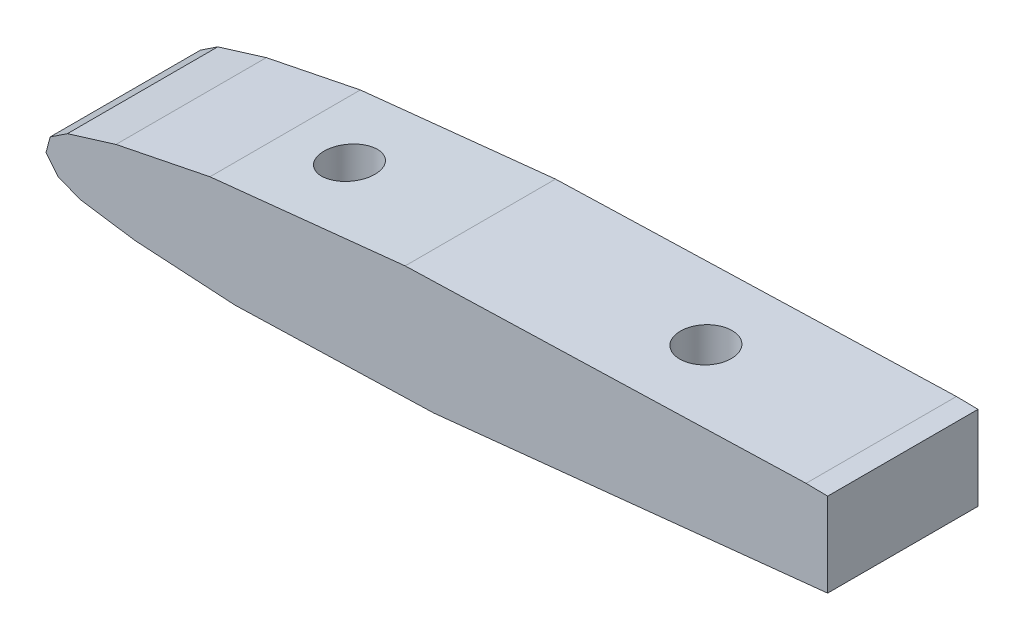
from build123d import *

# Parameters (mm, degrees)
BOSS_EXTRUDE1_DEPTH = 15
SKETCH4_R           = 2.54
CUT_EXTRUDE1_DEPTH  = 12.7
SKETCH5_R           = 2.54
CUT_EXTRUDE2_DEPTH  = 15.24
SKETCH6_W           = 50.620820664
SKETCH6_H           = 16.798394225
CUT_EXTRUDE3_DEPTH  = 15.24


with BuildPart() as part:
    # Sketch1 → Boss-Extrude1 (new body)
    with BuildSketch(Plane.XY):
        Polygon((-45.368681743, 5.31474447), (-45.781639963, 3.744360676), (-44.597190062, 2.280798517), (-42.364651707, 1.40510115), (-36.927606101, 0.59697268), (-26.918722281, 0), (-7.083221645, 0.593485987), (32.186093563, 4.677985502), (81.310277275, 12.243232279), (30.045684711, 13.095295678), (-9.952974473, 11.878999191), (-29.421950259, 9.844122216), (-38.797603286, 7.950869725), (-43.648710425, 6.454753464), align=None)
    extrude(amount=BOSS_EXTRUDE1_DEPTH)

    # Sketch4 → Cut-Extrude1 (cut)
    with BuildSketch(Plane(origin=(0, 0, 0), x_dir=(1, 0, 0), z_dir=(0, 1, 0))):
        with Locations(Location((-23.007190062, -7.5, 0), (0, 0, 180))):
            Circle(SKETCH4_R)
    extrude(amount=CUT_EXTRUDE1_DEPTH, mode=Mode.SUBTRACT)

    # Sketch5 → Cut-Extrude2 (cut)
    with BuildSketch(Plane(origin=(0, 0, 0), x_dir=(1, 0, 0), z_dir=(0, 1, 0))):
        with Locations(Location((12.552809938, -7.5, 0), (0, 0, 180))):
            Circle(SKETCH5_R)
    extrude(amount=CUT_EXTRUDE2_DEPTH, mode=Mode.SUBTRACT)

    # Sketch6 → Cut-Extrude3 (cut)
    with BuildSketch(Plane(origin=(0, 0, 0), x_dir=(1, 0, 0), z_dir=(0, 1, 0))):
        with Locations((57.506978049, -7.112855452)):
            Rectangle(SKETCH6_W, SKETCH6_H)
    extrude(amount=CUT_EXTRUDE3_DEPTH, mode=Mode.SUBTRACT)


solid = part.part
